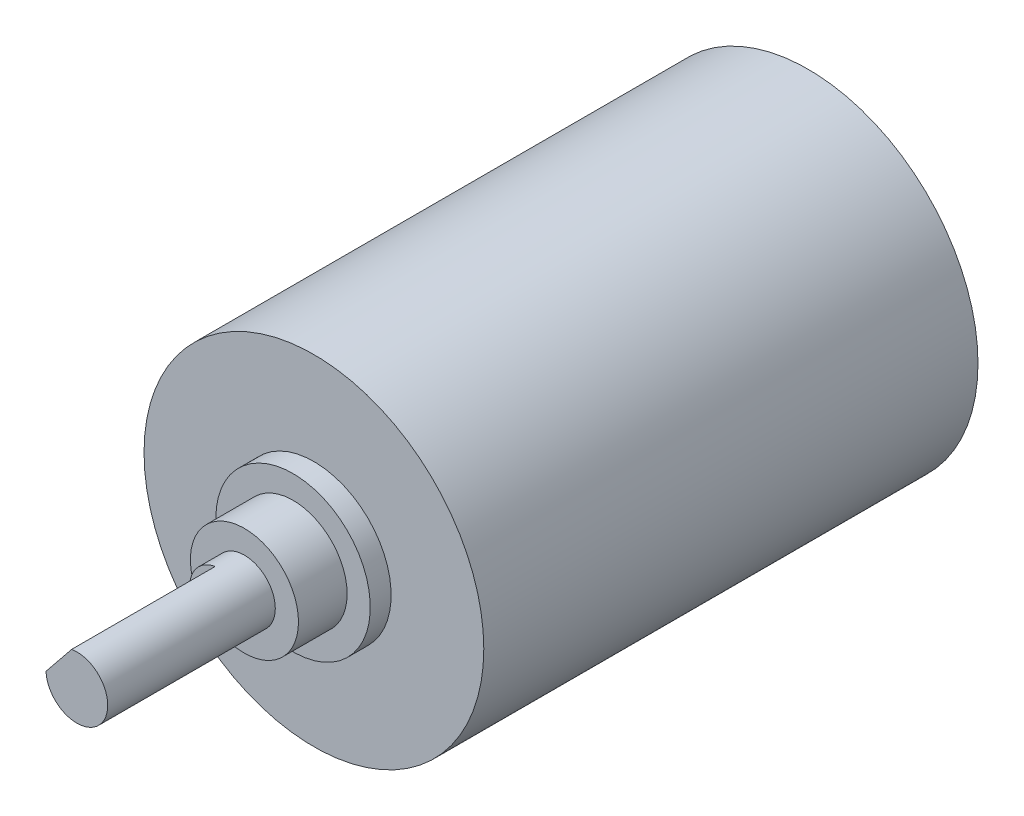
from build123d import *

# Parameters (mm, degrees)
SKETCH1_R           = 11
BOSS_EXTRUDE1_DEPTH = 32
SKETCH2_R           = 5
BOSS_EXTRUDE2_DEPTH = 1.35
SKETCH3_R           = 3.5
BOSS_EXTRUDE4_DEPTH = 3.15
SKETCH4_R           = 2
BOSS_EXTRUDE5_DEPTH = 10.85
CUT_EXTRUDE1_START  = -9.3
CUT_EXTRUDE1_DEPTH  = 9.3


with BuildPart() as part:
    # Sketch1 → Boss-Extrude1 (new body)
    with BuildSketch(Plane.XY):
        Circle(SKETCH1_R)
    extrude(amount=BOSS_EXTRUDE1_DEPTH)

    # Sketch2 → Boss-Extrude2 (add)
    with BuildSketch(Plane.XY.offset(32)):
        with Locations(Location((0, 0, 0), (0, 0, 180))):
            Circle(SKETCH2_R)
    extrude(amount=BOSS_EXTRUDE2_DEPTH)

    # Sketch3 → Boss-Extrude4 (add)
    with BuildSketch(Plane.XY.offset(33.35)):
        Circle(SKETCH3_R)
    extrude(amount=BOSS_EXTRUDE4_DEPTH)

    # Sketch4 → Boss-Extrude5 (add)
    with BuildSketch(Plane.XY.offset(36.5)):
        Circle(SKETCH4_R)
    extrude(amount=BOSS_EXTRUDE5_DEPTH)

    # Sketch5 → Cut-Extrude1 (cut)
    with BuildSketch(Plane.XY.offset(47.35).offset(CUT_EXTRUDE1_START)):
        with BuildLine():
            Line((-0.338013059, 1.971229863), (-1.99802063, -0.088958203))
            ThreePointArc((-1.99802063, -0.088958203), (-1.557355793, 1.254847773), (-0.338013059, 1.971229863))
        make_face()
    extrude(amount=CUT_EXTRUDE1_DEPTH, mode=Mode.SUBTRACT)


solid = part.part
